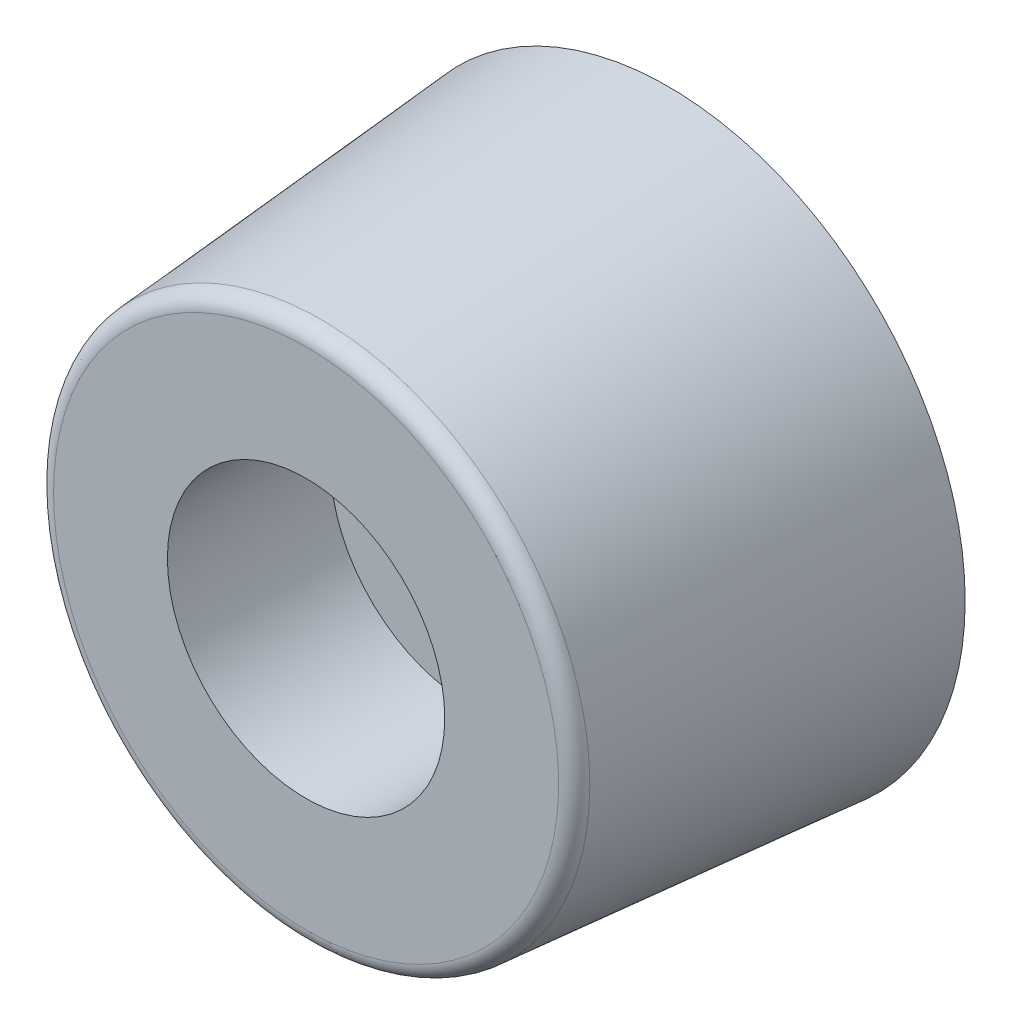
from build123d import *


with BuildPart() as part:
    # Sketch1 → Revolve1 (revolve)
    with BuildSketch(Plane(origin=(0, 0, 0), x_dir=(0, 0, -1), z_dir=(1, 0, 0)), mode=Mode.PRIVATE) as revolve1_sk:
        with BuildLine():
            Line((0, 2.45), (0, 4.25))
            Line((0, 4.25), (-5, 4.25))
            Line((-5, 4.25), (-5, 7.738899697))
            ThreePointArc((-5, 7.738899697), (-4.867562217, 8.077865797), (-4.540407934, 8.237264222))
            Line((-4.540407934, 8.237264222), (6.1, 9.1))
            Line((6.1, 9.1), (6.1, 2.85))
            Line((6.1, 2.85), (3.8, 2.85))
            Line((3.8, 2.85), (3.8, 2.45))
            Line((3.8, 2.45), (0, 2.45))
        make_face()
    revolve(revolve1_sk.sketch.rotate(Axis((0, 0, 0), (0, 0, 1)), 90), axis=Axis((0, 0, 0), (0, 0, 1)))


solid = part.part
